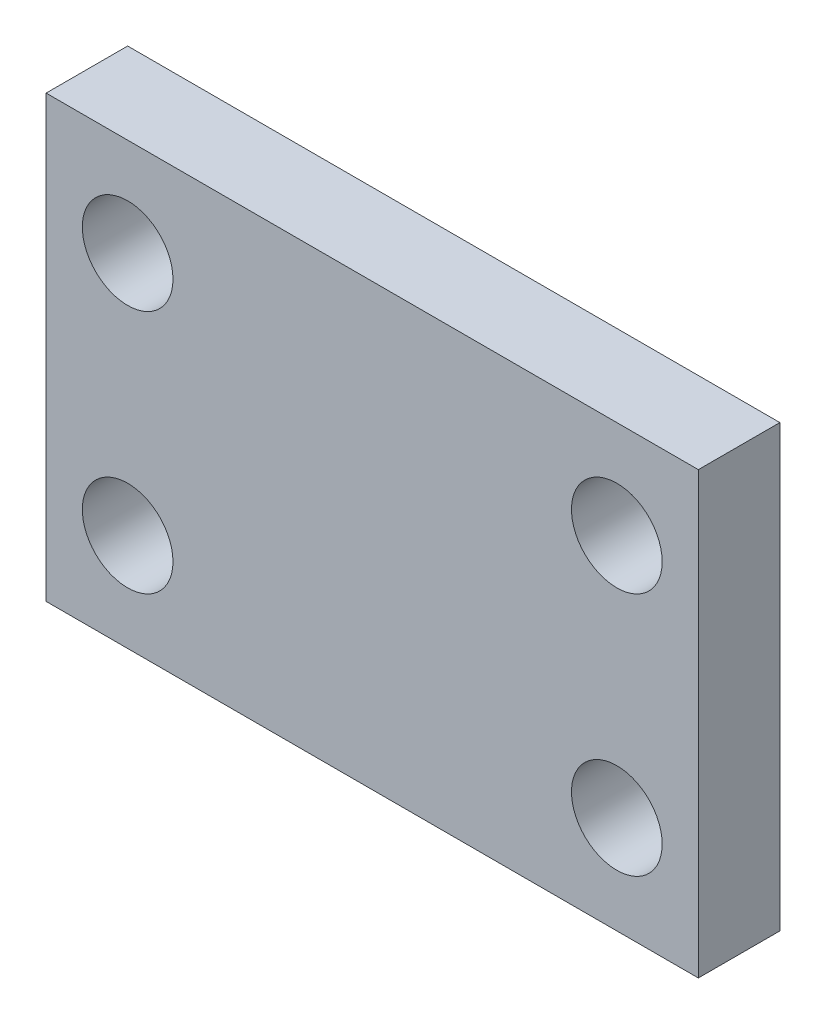
from build123d import *

# Parameters (mm, degrees)
SKETCH1_W          = 25.4
SKETCH1_H          = 17.145
EXTRUDE1_DEPTH     = 3.175
SKETCH2_R          = 1.7653
CUT_EXTRUDE1_DEPTH = 3.175


with BuildPart() as part:
    # Sketch1 → Extrude1 (new body)
    with BuildSketch(Plane.XY):
        Rectangle(SKETCH1_W, SKETCH1_H)
    extrude(amount=EXTRUDE1_DEPTH)

    # Sketch2 → Cut-Extrude1 (cut)
    with BuildSketch(Plane.XY.offset(3.175)):
        with Locations((-9.525, 4.7625)):
            Circle(SKETCH2_R)
        with Locations((9.525, 4.7625)):
            Circle(SKETCH2_R)
        with Locations((9.525, -4.7625)):
            Circle(SKETCH2_R)
        with Locations((-9.525, -4.7625)):
            Circle(SKETCH2_R)
    extrude(amount=-CUT_EXTRUDE1_DEPTH, mode=Mode.SUBTRACT)


solid = part.part
